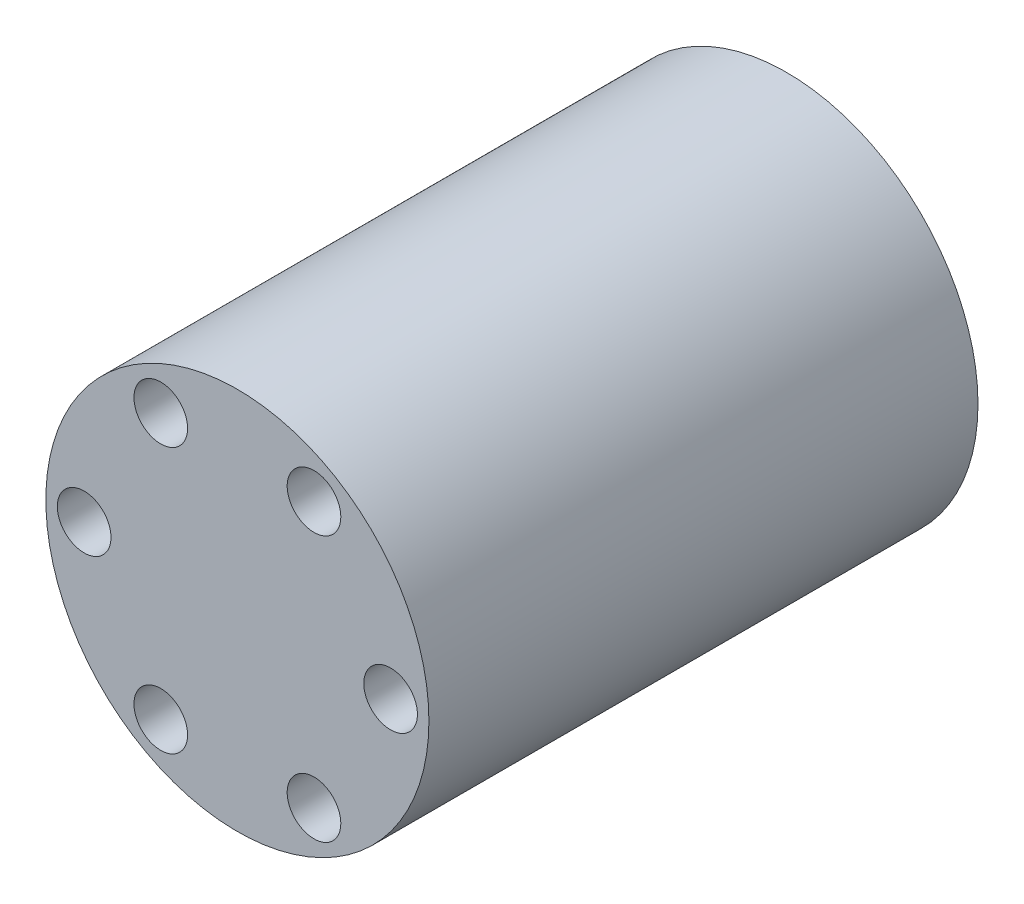
from build123d import *

# Parameters (mm, degrees)
SKETCH1_R           = 15
BOSS_EXTRUDE1_DEPTH = 21.5
SKETCH2_R           = 2.1
CUT_EXTRUDE1_DEPTH  = 48.947888379


with BuildPart() as part:
    # Sketch1 → Boss-Extrude1 (new, symmetric)
    with BuildSketch(Plane.XY):
        Circle(SKETCH1_R)
    extrude(amount=BOSS_EXTRUDE1_DEPTH, both=True)

    # Sketch2 → Cut-Extrude1 (cut, through all)
    with BuildSketch(Plane.XY.offset(21.5)):
        with Locations((-12, 0)):
            Circle(SKETCH2_R)
        with Locations((-6, 10.392304845)):
            Circle(SKETCH2_R)
        with Locations((6, 10.392304845)):
            Circle(SKETCH2_R)
        with Locations((12, 0)):
            Circle(SKETCH2_R)
        with Locations((6, -10.392304845)):
            Circle(SKETCH2_R)
        with Locations((-6, -10.392304845)):
            Circle(SKETCH2_R)
    extrude(amount=-CUT_EXTRUDE1_DEPTH, mode=Mode.SUBTRACT)


solid = part.part
